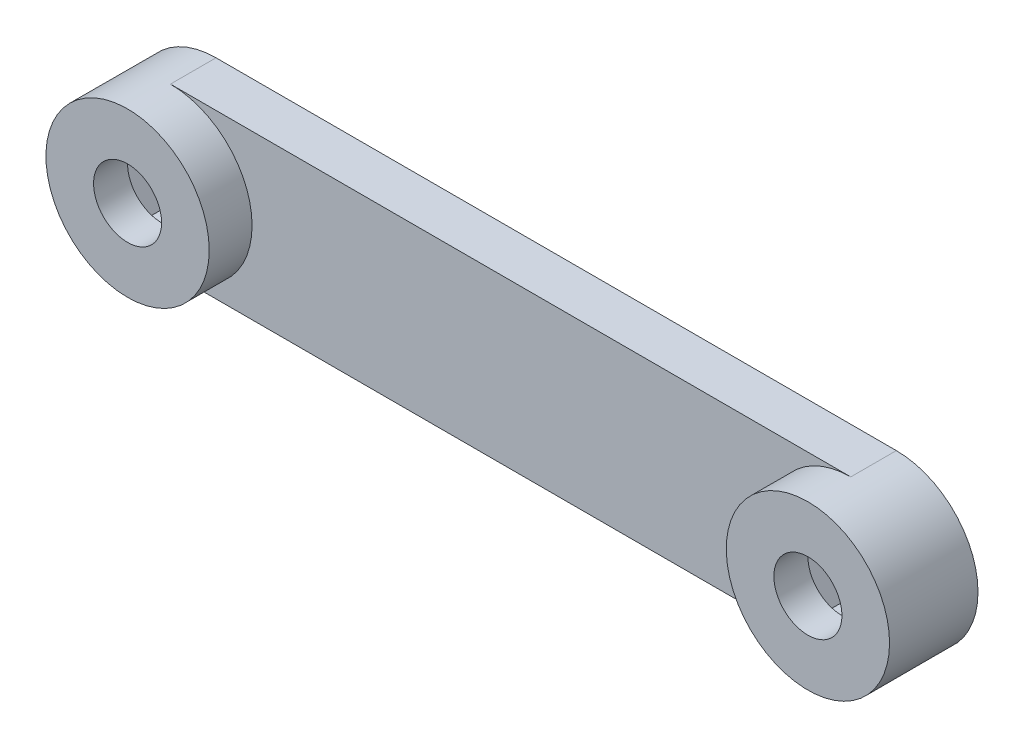
from build123d import *

# Parameters (mm, degrees)
SKETCH1_R           = 2.5
BOSS_EXTRUDE1_DEPTH = 3.35
SKETCH2_R           = 6
SKETCH2_R_2         = 2.5
BOSS_EXTRUDE2_DEPTH = 3.15
CUT_EXTRUDE1_DEPTH  = 4


with BuildPart() as part:
    # Sketch1 → Boss-Extrude1 (new body)
    with BuildSketch(Plane.XY):
        with BuildLine():
            Line((-25, -6), (25, -6))
            ThreePointArc((25, -6), (31, 0), (25, 6))
            Line((25, 6), (-25, 6))
            ThreePointArc((-25, 6), (-31, 0), (-25, -6))
        make_face()
        with Locations((-25, 0)):
            Circle(SKETCH1_R, mode=Mode.SUBTRACT)
        with Locations((25, 0)):
            Circle(SKETCH1_R, mode=Mode.SUBTRACT)
    extrude(amount=BOSS_EXTRUDE1_DEPTH)

    # Sketch2 → Boss-Extrude2 (add)
    # profile 1 of 2: a face of its own
    with BuildSketch(Plane.XY.offset(3.35)):
        with Locations(Location((-25, 0, 0), (0, 0, 270))):
            Circle(SKETCH2_R)
        with Locations((-25, 0)):
            Circle(SKETCH2_R_2, mode=Mode.SUBTRACT)
    # profile 2 of 2: a face of its own
    with BuildSketch(Plane.XY.offset(3.35)):
        with Locations(Location((25, 0, 0), (0, 0, 90))):
            Circle(SKETCH2_R)
        with Locations((25, 0)):
            Circle(SKETCH2_R_2, mode=Mode.SUBTRACT)
    extrude(amount=BOSS_EXTRUDE2_DEPTH)

    # Sketch3 → Cut-Extrude1 (cut)
    with BuildSketch(Plane(origin=(0, 0, 0), x_dir=(-1, 0, 0), z_dir=(0, 0, -1))):
        Polygon((20.438932873, 0), (22.719466437, 3.95), (27.280533563, 3.95), (29.561067127, 0), (27.280533563, -3.95), (22.719466437, -3.95), align=None)
        Polygon((-22.719466437, 3.95), (-27.280533563, 3.95), (-29.561067127, 0), (-27.280533563, -3.95), (-22.719466437, -3.95), (-20.438932873, 0), align=None)
    extrude(amount=-CUT_EXTRUDE1_DEPTH, mode=Mode.SUBTRACT)


solid = part.part
